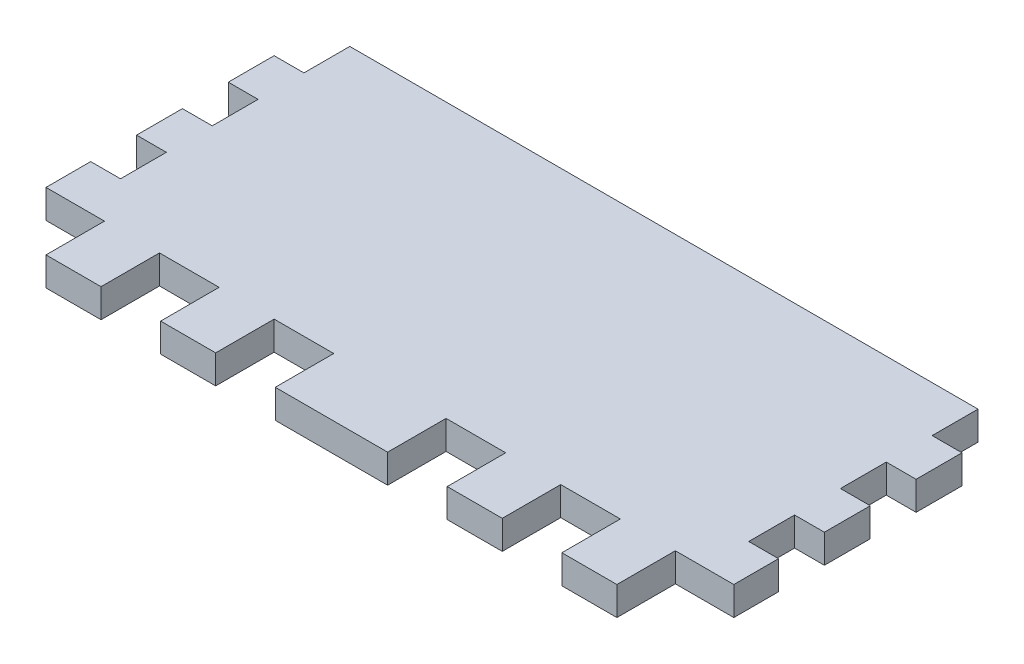
from build123d import *

# Parameters (mm, degrees)
SKETCH1_W           = 76.2
SKETCH1_H           = 30.48
BOSS_EXTRUDE1_DEPTH = 3.175
SKETCH5_W           = 3.302
SKETCH5_H           = 5.08
CUT_EXTRUDE2_DEPTH  = 42.157602275
SKETCH6_W           = 76.2
SKETCH6_H           = 6.35
BOSS_EXTRUDE3_DEPTH = 3.175
SKETCH7_W           = 6.604
SKETCH7_H           = 6.604
CUT_EXTRUDE3_DEPTH  = 44.906932539


with BuildPart() as part:
    # Sketch1 → Boss-Extrude1 (new body)
    with BuildSketch(Plane(origin=(0, 0, 0), x_dir=(1, 0, 0), z_dir=(0, 1, 0))):
        Rectangle(SKETCH1_W, SKETCH1_H)
    extrude(amount=BOSS_EXTRUDE1_DEPTH)

    # Sketch5 → Cut-Extrude2 (cut, through all)
    with BuildSketch(Plane(origin=(0, 3.175, 0), x_dir=(1, 0, 0), z_dir=(0, 1, 0))):
        with Locations((-36.449, 2.54)):
            Rectangle(SKETCH5_W, SKETCH5_H)
        with Locations((-36.449, 12.7)):
            Rectangle(SKETCH5_W, SKETCH5_H)
        with Locations((-36.449, -7.62)):
            Rectangle(SKETCH5_W, SKETCH5_H)
        with Locations((36.449, -7.62)):
            Rectangle(SKETCH5_W, SKETCH5_H)
        with Locations((36.449, 2.54)):
            Rectangle(SKETCH5_W, SKETCH5_H)
        with Locations((36.449, 12.7)):
            Rectangle(SKETCH5_W, SKETCH5_H)
    extrude(amount=-CUT_EXTRUDE2_DEPTH, mode=Mode.SUBTRACT)

    # Sketch6 → Boss-Extrude3 (add)
    with BuildSketch(Plane(origin=(0, 3.175, 0), x_dir=(1, 0, 0), z_dir=(0, 1, 0))):
        with Locations((0, -18.415)):
            Rectangle(SKETCH6_W, SKETCH6_H)
    extrude(amount=-BOSS_EXTRUDE3_DEPTH)

    # Sketch7 → Cut-Extrude3 (cut, through all)
    with BuildSketch(Plane(origin=(0, 3.175, 0), x_dir=(1, 0, 0), z_dir=(0, 1, 0))):
        with Locations((-34.925, -18.415)):
            Rectangle(SKETCH7_W, SKETCH7_H)
        with Locations((-22.225, -18.415)):
            Rectangle(SKETCH7_W, SKETCH7_H)
        with Locations((-9.525, -18.415)):
            Rectangle(SKETCH7_W, SKETCH7_H)
        with Locations((9.525, -18.415)):
            Rectangle(SKETCH7_W, SKETCH7_H)
        with Locations((22.225, -18.415)):
            Rectangle(SKETCH7_W, SKETCH7_H)
        with Locations((34.925, -18.415)):
            Rectangle(SKETCH7_W, SKETCH7_H)
    extrude(amount=-CUT_EXTRUDE3_DEPTH, mode=Mode.SUBTRACT)


solid = part.part
